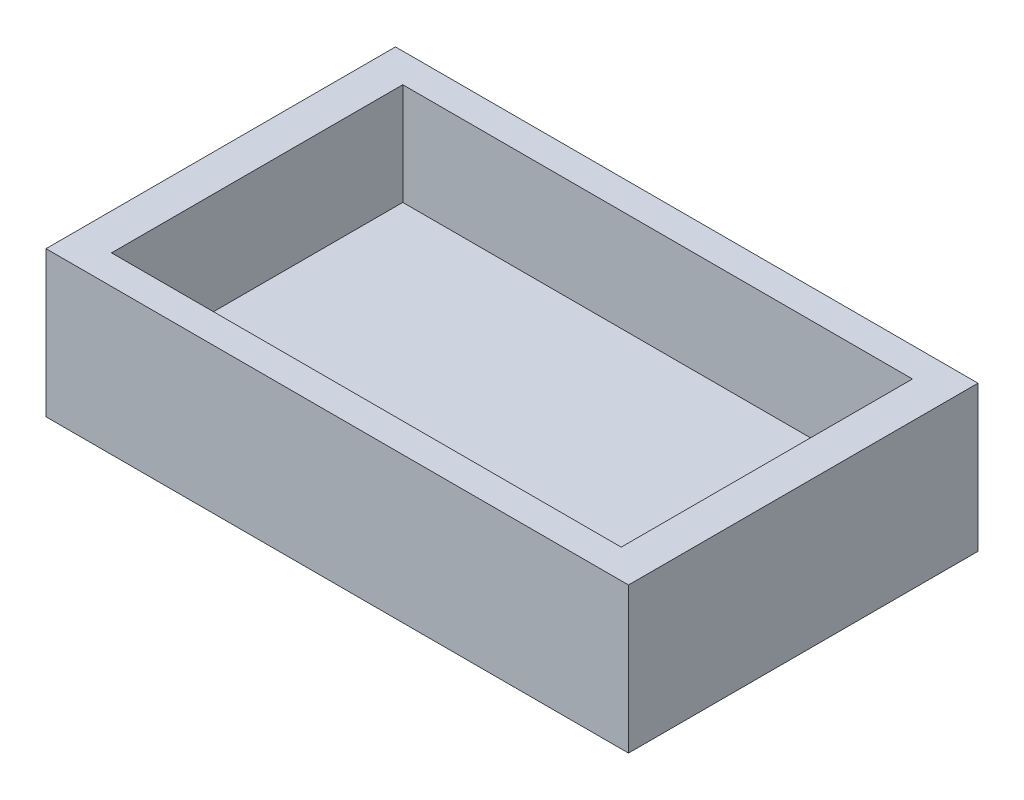
from build123d import *

# Parameters (mm, degrees)
SKETCH2_W           = 40
SKETCH2_H           = 24
BOSS_EXTRUDE1_DEPTH = 10
SKETCH3_W           = 35
SKETCH3_H           = 20
CUT_EXTRUDE1_DEPTH  = 7


with BuildPart() as part:
    # Sketch2 → Boss-Extrude1 (new body)
    with BuildSketch(Plane(origin=(0, 0, 0), x_dir=(1, 0, 0), z_dir=(0, 1, 0))):
        Rectangle(SKETCH2_W, SKETCH2_H)
    extrude(amount=BOSS_EXTRUDE1_DEPTH)

    # Sketch3 → Cut-Extrude1 (cut)
    with BuildSketch(Plane(origin=(0, 10, 0), x_dir=(1, 0, 0), z_dir=(0, 1, 0))):
        Rectangle(SKETCH3_W, SKETCH3_H)
    extrude(amount=-CUT_EXTRUDE1_DEPTH, mode=Mode.SUBTRACT)

    # Sketch9 → Loft1 section 0
    with BuildSketch(Plane.XZ, mode=Mode.PRIVATE) as loft1_s0:
        with BuildLine():
            Line((20, -12), (-20, -12))
            Line((-20, -12), (-20, 12))
            Line((-20, 12), (20, 12))
            Line((20, 12), (20, -12))
        make_face()
    loft([loft1_s0.sketch, Vertex(0, -10, 0)])


solid = part.part
